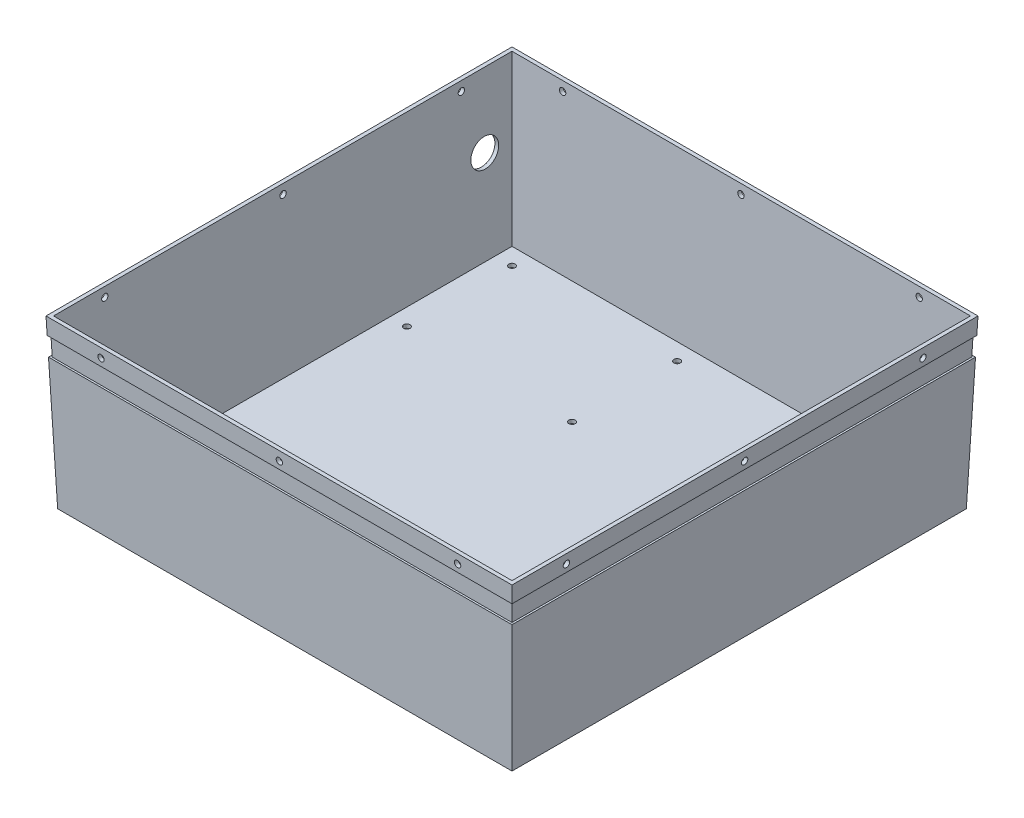
from build123d import *

# Parameters (mm, degrees)
SKETCH1_W                       = 242.1
SKETCH1_H                       = 242.1
BOSS_EXTRUDE1_DEPTH             = 90
BOSS_EXTRUDE1_DRAFT             = -2
SHELL1_T                        = -2
CUT_EXTRUDE7_DEPTH              = 291.648708719
CUT_EXTRUDE8_DEPTH              = 291.648708719
M3_CLEARANCE_HOLE2_D            = 3.4
SKETCH15_R                      = 1.7
CUT_EXTRUDE9_DEPTH              = 10
SKETCH16_R                      = 1.7
CUT_EXTRUDE10_DEPTH             = 10
CUT_EXTRUDE11_DEPTH             = 198.351811614
CUT_EXTRUDE11_DEPTH_BACK        = 198.351811614
CUT_EXTRUDE12_REACH             = 292.104
SKETCH21_R                      = 7.4
CUT_EXTRUDE12_DIRECTION_2_DEPTH = 291.103764671


with BuildPart() as part:
    # Sketch1 → Boss-Extrude1 (with draft: the straight prism first)
    with BuildSketch(Plane(origin=(0, 0, 0), x_dir=(1, 0, 0), z_dir=(0, 1, 0))):
        Rectangle(SKETCH1_W, SKETCH1_H)
    extrude(amount=BOSS_EXTRUDE1_DEPTH)
    # Boss-Extrude1: the draft: its side faces are tilted about the plane it starts from
    boss_extrude1_sides = [part.faces().sort_by_distance(p)[0] for p in [
        (0, 45, 121.05),
        (121.05, 45, 0),
        (0, 45, -121.05),
        (-121.05, 45, 0),
    ]]
    draft(boss_extrude1_sides, Plane(origin=(0, 0, 0), x_dir=(1, 0, 0), z_dir=(0, 1, 0)), BOSS_EXTRUDE1_DRAFT)

    # Shell1
    shell1_openings = [part.faces().sort_by_distance(p)[0] for p in [
        (0, 90, 0),
    ]]
    offset(amount=SHELL1_T, openings=shell1_openings, kind=Kind.INTERSECTION)

    # Sketch6 → Cut-Extrude7 (cut, through all, along a direction that is not the sketch's normal)
    with BuildSketch(Plane(origin=(0, -4.222010573, 120.902564142), x_dir=(1, 0, 0), z_dir=(0, -0.03489949670250105, 0.9993908270190958))):
        Polygon((-123.843874287, 84.279443063), (-123.49509166, 74.28552738), (-122.494482858, 74.28552738), (-122.843265485, 84.279443063), align=None)
    cut_extrude7 = extrude(amount=-CUT_EXTRUDE7_DEPTH, dir=(0, 0, 1), mode=Mode.SUBTRACT)

    # Sketch7 → Cut-Extrude8 (cut, through all, along a direction that is not the sketch's normal)
    with BuildSketch(Plane(origin=(-120.902564142, -4.222010573, 0), x_dir=(0, 0, 1), z_dir=(-0.9993908270190958, -0.03489949670250105, 0))):
        Polygon((123.845093004, 84.279443063), (122.845093004, 84.279443063), (122.496310376, 74.28552738), (123.496310376, 74.28552738), align=None)
    cut_extrude8 = extrude(amount=-CUT_EXTRUDE8_DEPTH, dir=(-1, 0, 0), mode=Mode.SUBTRACT)

    # Mirror1: Cut-Extrude7 across plane
    add(cut_extrude7.mirror(Plane(origin=(0, 0, 0), x_dir=(0, 0, 1), z_dir=(1, 0, 0))), mode=Mode.SUBTRACT)

    # Mirror2: Cut-Extrude8 across plane
    add(cut_extrude8.mirror(Plane.XY), mode=Mode.SUBTRACT)

    # M3 Clearance Hole2 (through all)
    with Locations(Plane(origin=(0, 2, 0), x_dir=(1, 0, 0), z_dir=(0, 1, 0))):
        with Locations((-110.11862245, 54.11862245), (-110.11862245, 110.11862245), (-22.11862245, 110.11862245), (-22.11862245, 54.11862245)):
            Hole(M3_CLEARANCE_HOLE2_D / 2)

    # Sketch15 → Cut-Extrude9 (cut)
    with BuildSketch(Plane(origin=(0, -4.222010573, 120.902564142), x_dir=(1, 0, 0), z_dir=(0, -0.03489949670250105, 0.9993908270190958))):
        with Locations(Location((0, 88.279443063, 0), (0, 0, 270))):
            Circle(SKETCH15_R)
        with Locations(Location((-95, 88.279443063, 0), (0, 0, 270))):
            Circle(SKETCH15_R)
        with Locations(Location((95, 88.279443063, 0), (0, 0, 270))):
            Circle(SKETCH15_R)
    cut_extrude9 = extrude(amount=-CUT_EXTRUDE9_DEPTH, mode=Mode.SUBTRACT)

    # Mirror3: Cut-Extrude9 across plane
    add(cut_extrude9.mirror(Plane.XY), mode=Mode.SUBTRACT)

    # Sketch16 → Cut-Extrude10 (cut)
    with BuildSketch(Plane(origin=(-120.902564142, -4.222010573, 0), x_dir=(0, 0, 1), z_dir=(-0.9993908270190958, -0.03489949670250105, 0))):
        with Locations(Location((0, 88.279443063, 0), (0, 0, 270))):
            Circle(SKETCH16_R)
        with Locations(Location((95, 88.279443063, 0), (0, 0, 270))):
            Circle(SKETCH16_R)
        with Locations(Location((-95, 88.279443063, 0), (0, 0, 270))):
            Circle(SKETCH16_R)
    cut_extrude10 = extrude(amount=-CUT_EXTRUDE10_DEPTH, mode=Mode.SUBTRACT)

    # Mirror4: Cut-Extrude10 across plane
    add(cut_extrude10.mirror(Plane(origin=(0, 0, 0), x_dir=(0, 0, 1), z_dir=(1, 0, 0))), mode=Mode.SUBTRACT)

    # Sketch18 → Cut-Extrude11 (cut, two sides: drawn at the far end of the back side and taken through both)
    with BuildSketch(Plane.XY.offset(-CUT_EXTRUDE11_DEPTH_BACK)):
        Polygon((-124.192869254, 90), (-124.157948485, 89), (124.157948485, 89), (124.192869254, 90), align=None)
    extrude(amount=CUT_EXTRUDE11_DEPTH + CUT_EXTRUDE11_DEPTH_BACK, mode=Mode.SUBTRACT)

    # Sketch21 → Cut-Extrude12 (cut, up to next)
    with BuildSketch(Plane(origin=(-120.902564142, -4.222010573, 0), x_dir=(0, 0, 1), z_dir=(-0.9993908270190958, -0.03489949670250105, 0)), mode=Mode.PRIVATE) as cut_extrude12_sk1:
        with Locations(Location((-106.300517026, 54.932485221, 0), (0, 0, 270))):
            Circle(SKETCH21_R)
    cut_extrude12_tool1 = extrude(cut_extrude12_sk1.sketch, amount=-CUT_EXTRUDE12_REACH, mode=Mode.PRIVATE) & part.part
    add(cut_extrude12_tool1.solids().sort_by_distance((-122.81968, 50.677011, -106.300517))[0], mode=Mode.SUBTRACT)

    # Sketch21 → Cut-Extrude12 direction 2 (cut)
    with BuildSketch(Plane(origin=(-120.902564142, -4.222010573, 0), x_dir=(0, 0, 1), z_dir=(-0.9993908270190958, -0.03489949670250105, 0))):
        with Locations(Location((-106.300517026, 54.932485221, 0), (0, 0, 270))):
            Circle(SKETCH21_R)
    extrude(amount=CUT_EXTRUDE12_DIRECTION_2_DEPTH, mode=Mode.SUBTRACT)


solid = part.part
